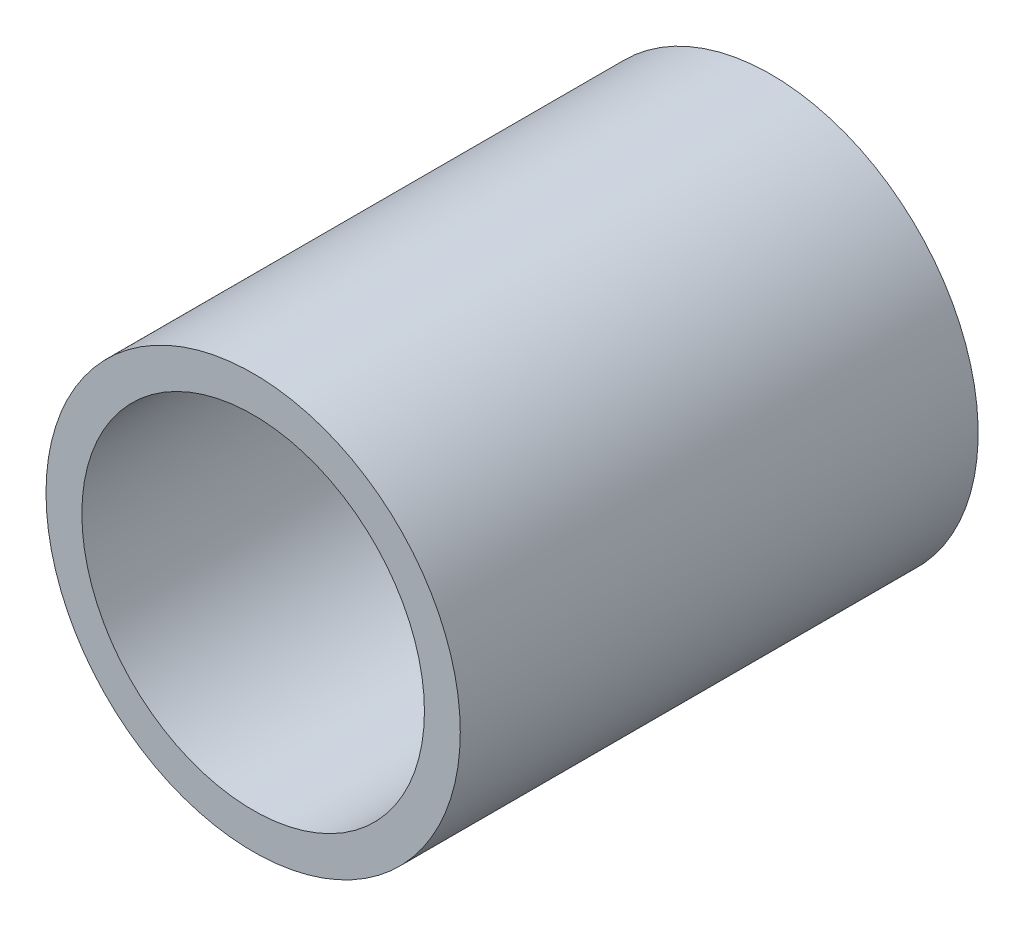
from build123d import *

# Parameters (mm, degrees)
SKETCH_1_R          = 2.6
EXTRUDE_1_DEPTH     = 1.5
SKETCH_2_R          = 1.1
CUT_EXTRUDE_1_DEPTH = 0.6
EXTRUDE_START       = 1
SKETCH_3_R          = 2.6
SKETCH_3_R_2        = 2.15
EXTRUDE_2_DEPTH     = 1
SKETCH_4_R          = 2.6
EXTRUDE_3_DEPTH     = 4
CUT_EXTRUDE_START   = -4.1
SKETCH_5_R          = 2.15
CUT_EXTRUDE_2_DEPTH = 4.1


with BuildPart() as part:
    # 草图1 → 凸台-拉伸1 (new body)
    with BuildSketch(Plane.XY):
        Circle(SKETCH_1_R)
    extrude(amount=EXTRUDE_1_DEPTH)

    # 草图2 → 切除-拉伸1 (cut)
    with BuildSketch(Plane(origin=(0, 0, 0), x_dir=(-1, 0, 0), z_dir=(0, 0, -1))):
        Circle(SKETCH_2_R)
    extrude(amount=-CUT_EXTRUDE_1_DEPTH, mode=Mode.SUBTRACT)

    # 草图3 → 凸台-拉伸2 (add)
    with BuildSketch(Plane(origin=(0, 0, 0), x_dir=(-1, 0, 0), z_dir=(0, 0, -1)).offset(EXTRUDE_START)):
        Circle(SKETCH_3_R)
        Circle(SKETCH_3_R_2, mode=Mode.SUBTRACT)
    extrude(amount=-EXTRUDE_2_DEPTH)

    # 草图4 → 凸台-拉伸3 (add)
    with BuildSketch(Plane.XY.offset(1.5)):
        with Locations(Location((0, 0, 0), (0, 0, 180))):
            Circle(SKETCH_4_R)
    extrude(amount=EXTRUDE_3_DEPTH)

    # 草图5 → 切除-拉伸2 (cut)
    with BuildSketch(Plane.XY.offset(5.5).offset(CUT_EXTRUDE_START)):
        with Locations(Location((0, 0, 0), (0, 0, 180))):
            Circle(SKETCH_5_R)
    extrude(amount=CUT_EXTRUDE_2_DEPTH, mode=Mode.SUBTRACT)


solid = part.part
